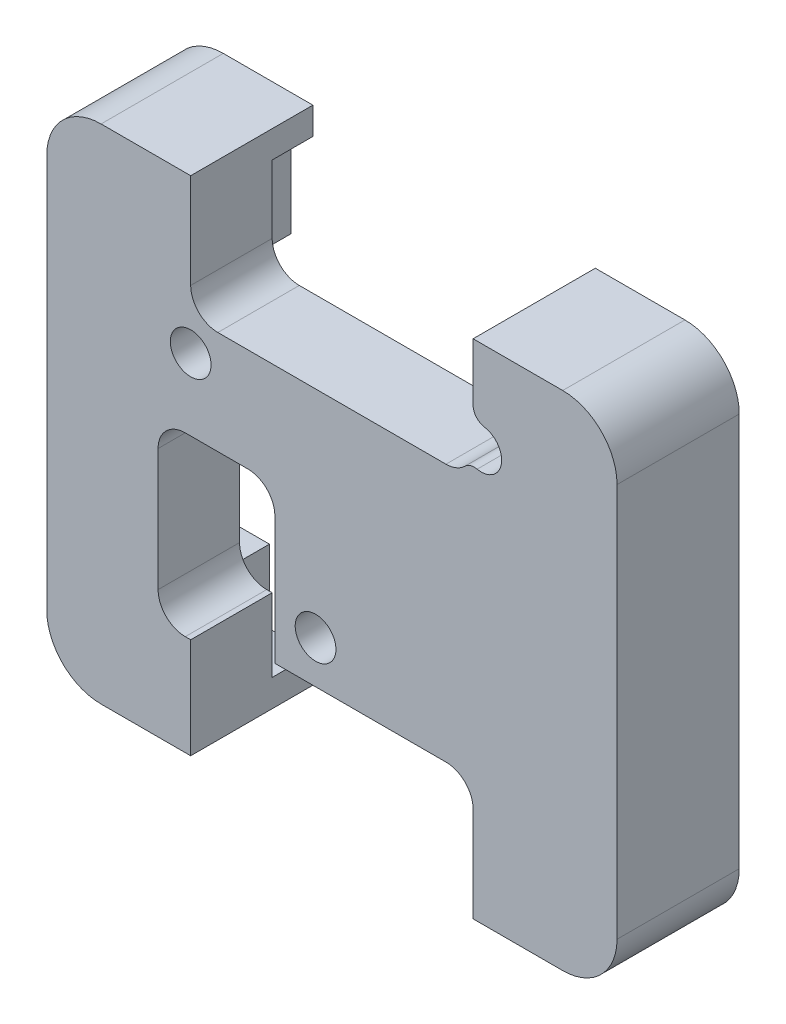
from build123d import *

# Parameters (mm, degrees)
BOSS_EXTRUDE1_DEPTH   = 1.5
BOSS_EXTRUDE1_2_DEPTH = 1.5
BOSS_EXTRUDE2_DEPTH   = 3
FILLET1_R             = 1
SKETCH3_R             = 0.75
CUT_EXTRUDE2_DEPTH    = 29.346075566
FILLET2_R             = 0.5


with BuildPart() as part:
    # Sketch1 → Boss-Extrude1 (new body)
    with BuildSketch(Plane.XY):
        with BuildLine():
            Line((2, 0), (5.3, 0))
            Line((5.3, 0), (5.3, 1))
            Line((5.3, 1), (3.7, 1))
            Line((3.7, 1), (3.7, 3.7))
            Line((3.7, 3.7), (1, 3.7))
            Line((1, 3.7), (1, 14))
            Line((1, 14), (4.5, 14))
            Line((4.5, 14), (4.5, 17.5))
            Line((4.5, 17.5), (5.3, 17.5))
            Line((5.3, 17.5), (5.3, 18.5))
            Line((5.3, 18.5), (2, 18.5))
            ThreePointArc((2, 18.5), (0.585786438, 17.914213562), (0, 16.5))
            Line((0, 16.5), (0, 2))
            ThreePointArc((0, 2), (0.585786438, 0.585786438), (2, 0))
        make_face()
    extrude(amount=BOSS_EXTRUDE1_DEPTH)



with BuildPart() as body_2:
    # Sketch1 → Boss-Extrude1 2 (new body)
    with BuildSketch(Plane.XY):
        with BuildLine():
            Line((21, 2), (21, 16.5))
            ThreePointArc((21, 16.5), (20.414213562, 17.914213562), (19, 18.5))
            Line((19, 18.5), (15.7, 18.5))
            Line((15.7, 18.5), (15.7, 17.5))
            Line((15.7, 17.5), (16.5, 17.5))
            Line((16.5, 17.5), (16.5, 14))
            Line((16.5, 14), (20, 14))
            Line((20, 14), (20, 2))
            ThreePointArc((20, 2), (19.707106781, 1.292893219), (19, 1))
            Line((19, 1), (15.7, 1))
            Line((15.7, 1), (15.7, 0))
            Line((15.7, 0), (19, 0))
            ThreePointArc((19, 0), (20.414213562, 0.585786438), (21, 2))
        make_face()
    extrude(amount=BOSS_EXTRUDE1_2_DEPTH)


with BuildPart() as part_1:
    add(part.part)

    add(body_2.part)  # Boss-Extrude2 merges body 2
    # Sketch2 → Boss-Extrude2 (add)
    with BuildSketch(Plane.XY.offset(1.5)):
        with BuildLine():
            Line((19, 18.5), (15.7, 18.5))
            Line((15.7, 18.5), (15.7, 14))
            Line((15.7, 14), (5.3, 14))
            Line((5.3, 14), (5.3, 18.5))
            Line((5.3, 18.5), (2, 18.5))
            ThreePointArc((2, 18.5), (0.585786438, 17.914213562), (0, 16.5))
            Line((0, 16.5), (0, 2))
            ThreePointArc((0, 2), (0.585786438, 0.585786438), (2, 0))
            Line((2, 0), (5.3, 0))
            Line((5.3, 0), (5.3, 3.7))
            Line((5.3, 3.7), (4.1, 3.7))
            Line((4.1, 3.7), (4.1, 10.2))
            Line((4.1, 10.2), (8.4, 10.2))
            Line((8.4, 10.2), (8.4, 4.5))
            Line((8.4, 4.5), (15.7, 4.5))
            Line((15.7, 4.5), (15.7, 0))
            Line((15.7, 0), (19, 0))
            ThreePointArc((19, 0), (20.414213562, 0.585786438), (21, 2))
            Line((21, 2), (21, 16.5))
            ThreePointArc((21, 16.5), (20.414213562, 17.914213562), (19, 18.5))
        make_face()
    extrude(amount=BOSS_EXTRUDE2_DEPTH)

    # Fillet1
    fillet1_edges = [part_1.edges().sort_by_distance(p)[0] for p in [
        (15.7, 14, 3),
        (5.3, 14, 3),
        (4.1, 3.7, 3),
        (4.1, 10.2, 3),
        (8.4, 10.2, 3),
        (15.7, 4.5, 3),
    ]]
    fillet(fillet1_edges, radius=FILLET1_R)

    # Sketch3 → Cut-Extrude2 (cut, through all)
    with BuildSketch(Plane.XY.offset(4.5)):
        with Locations((9.898564471, 6.065663219)):
            Circle(SKETCH3_R)
        with Locations((5.3005196, 12.837006018)):
            Circle(SKETCH3_R)
        with Locations((16, 15.15)):
            Circle(SKETCH3_R)
    extrude(amount=-CUT_EXTRUDE2_DEPTH, mode=Mode.SUBTRACT)

    # Fillet2
    fillet2_edges = [part_1.edges().sort_by_distance(p)[0] for p in [
        (15.581422532, 14.527671386, 3),
        (15.7, 15.837386354, 3),
    ]]
    fillet(fillet2_edges, radius=FILLET2_R)


solid = part_1.part
